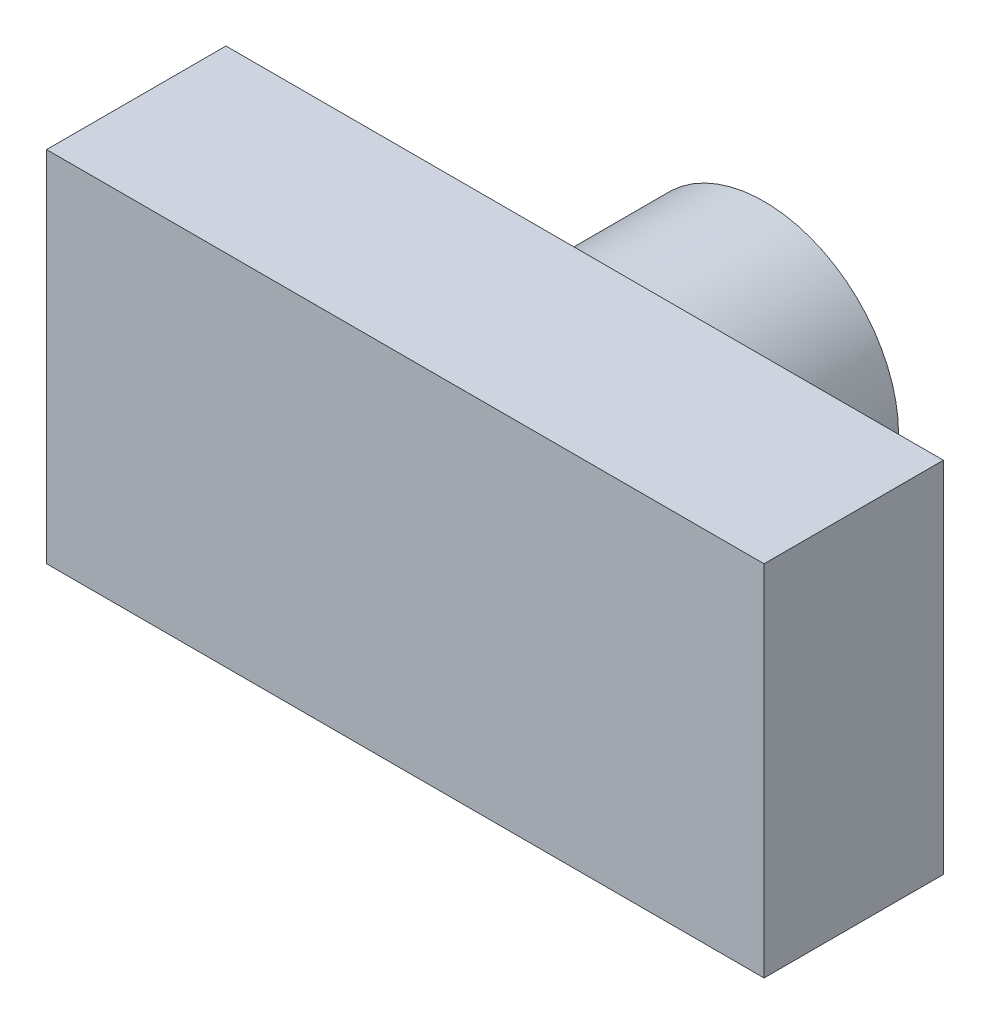
from build123d import *

# Parameters (mm, degrees)
SKETCH1_W           = 101.6
SKETCH1_H           = 50.8
BOSS_EXTRUDE1_DEPTH = 25.4
SKETCH2_R           = 19.05
BOSS_EXTRUDE2_DEPTH = 25.4


with BuildPart() as part:
    # Sketch1 → Boss-Extrude1 (new body)
    with BuildSketch(Plane.XY):
        Rectangle(SKETCH1_W, SKETCH1_H)
    extrude(amount=BOSS_EXTRUDE1_DEPTH)

    # Sketch2 → Boss-Extrude2 (add)
    with BuildSketch(Plane(origin=(0, 0, 0), x_dir=(-1, 0, 0), z_dir=(0, 0, -1))):
        Circle(SKETCH2_R)
    extrude(amount=BOSS_EXTRUDE2_DEPTH)


solid = part.part
